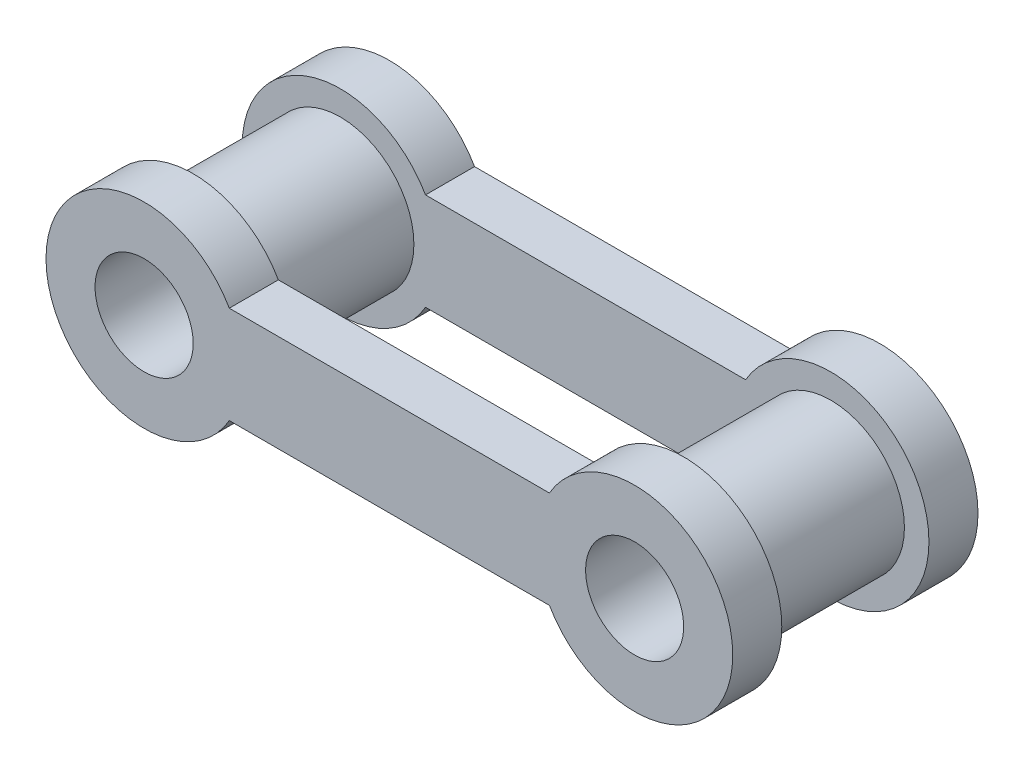
from build123d import *
from build123d.topology import SkipClean

# Parameters (mm, degrees)
SKETCH_1_R      = 2
EXTRUDE_1_DEPTH = 2
EXTRUDE_START   = 6
SKETCH_2_R      = 3
SKETCH_2_R_2    = 2
EXTRUDE_2_DEPTH = 6


with BuildPart() as part:
    # 草图1 → 凸台-拉伸1 (new body)
    with BuildSketch(Plane.XY):
        with BuildLine():
            Line((-0.652657961, 3.769166536), (12.40050126, 3.769166536))
            ThreePointArc((12.40050126, 3.769166536), (19.873921649, 1.785394675), (12.40050126, -0.198377186))
            Line((12.40050126, -0.198377186), (-0.652657961, -0.198377186))
            ThreePointArc((-0.652657961, -0.198377186), (-8.126078351, 1.785394675), (-0.652657961, 3.769166536))
        make_face()
        with Locations((-4.126078351, 1.785394675)):
            Circle(SKETCH_1_R, mode=Mode.SUBTRACT)
        with Locations(Location((15.873921649, 1.785394675, 0), (0, 0, 180))):
            Circle(SKETCH_1_R, mode=Mode.SUBTRACT)
    extrude_1 = extrude(amount=EXTRUDE_1_DEPTH)

    # 草图2 → 凸台-拉伸2 (add)
    # profile 1 of 2: a face of its own
    with SkipClean():  # the faces are left unmerged after this step: merging them gives an invalid solid
        with BuildSketch(Plane(origin=(0, 0, 0), x_dir=(-1, 0, 0), z_dir=(0, 0, -1)).offset(EXTRUDE_START)):
            with Locations(Location((-15.873921649, 1.785394675, 0), (0, 0, 180))):
                Circle(SKETCH_2_R)
            with Locations((-15.873921649, 1.785394675)):
                Circle(SKETCH_2_R_2, mode=Mode.SUBTRACT)
        # profile 2 of 2: a face of its own
        with BuildSketch(Plane(origin=(0, 0, 0), x_dir=(-1, 0, 0), z_dir=(0, 0, -1)).offset(EXTRUDE_START)):
            with Locations(Location((4.126078351, 1.785394675, 0), (0, 0, 180))):
                Circle(SKETCH_2_R)
            with Locations((4.126078351, 1.785394675)):
                Circle(SKETCH_2_R_2, mode=Mode.SUBTRACT)
        extrude(amount=-EXTRUDE_2_DEPTH)

    # 镜向1: 凸台-拉伸1 across plane
    with SkipClean():  # the faces are left unmerged after this step: merging them gives an invalid solid
        add(extrude_1.mirror(Plane(origin=(0, 0, -3), x_dir=(1, 0, 0), z_dir=(0, 0, -1))))


solid = part.part
